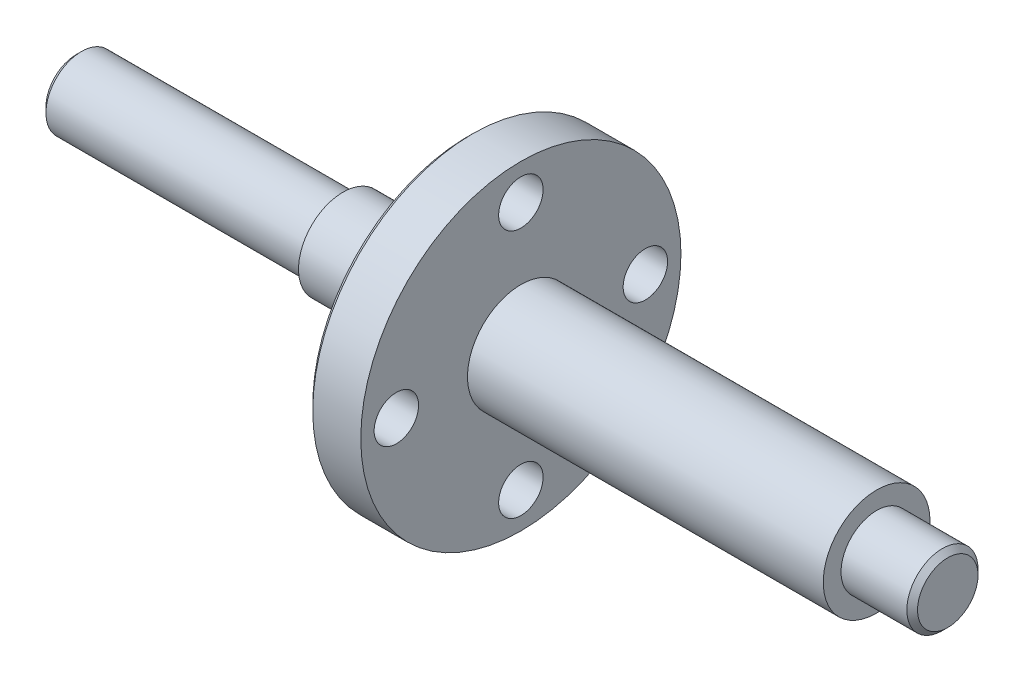
from build123d import *

# Parameters (mm, degrees)
SKETCH_1_R               = 2
EXTRUDE_1_DEPTH          = 15
SKETCH_2_R               = 2.5
EXTRUDE_2_DEPTH          = 4
SKETCH_3_R               = 3
EXTRUDE_3_DEPTH          = 3
SKETCH_4_R               = 9
EXTRUDE_4_DEPTH          = 3
SKETCH_5_R               = 3
EXTRUDE_5_DEPTH          = 20
SKETCH_8_R               = 2
EXTRUDE_6_DEPTH          = 4
HOLE_WIZARD_M3_2_D       = 2.5
PATTERN_CIRCULAR_2_COUNT = 4
CHAMFER_1_SIZE           = 0.3


with BuildPart() as part:
    # 草图1 → 凸台-拉伸1 (new body)
    with BuildSketch(Plane(origin=(0, 0, 0), x_dir=(0, 0, -1), z_dir=(1, 0, 0))):
        Circle(SKETCH_1_R)
    extrude(amount=EXTRUDE_1_DEPTH)

    # 草图2 → 凸台-拉伸2 (add)
    with BuildSketch(Plane(origin=(15, 0, 0), x_dir=(0, 0, -1), z_dir=(1, 0, 0))):
        Circle(SKETCH_2_R)
    extrude(amount=EXTRUDE_2_DEPTH)

    # 草图3 → 凸台-拉伸3 (add)
    with BuildSketch(Plane(origin=(19, 0, 0), x_dir=(0, 0, -1), z_dir=(1, 0, 0))):
        Circle(SKETCH_3_R)
    extrude(amount=EXTRUDE_3_DEPTH)

    # 草图4 → 凸台-拉伸4 (add)
    with BuildSketch(Plane(origin=(22, 0, 0), x_dir=(0, 0, -1), z_dir=(1, 0, 0))):
        Circle(SKETCH_4_R)
    extrude(amount=EXTRUDE_4_DEPTH)

    # 草图5 → 凸台-拉伸5 (add)
    with BuildSketch(Plane(origin=(25, 0, 0), x_dir=(0, 0, -1), z_dir=(1, 0, 0))):
        Circle(SKETCH_5_R)
    extrude(amount=EXTRUDE_5_DEPTH)

    # 草图8 → 凸台-拉伸6 (add)
    with BuildSketch(Plane(origin=(45, 0, 0), x_dir=(0, 0, -1), z_dir=(1, 0, 0))):
        Circle(SKETCH_8_R)
    extrude(amount=EXTRUDE_6_DEPTH)

    # M3 螺纹孔2 (through all)
    with Locations(Plane.ZY.offset(-22)):
        with Locations((0, 7)):
            hole_wizard_m3_2 = Hole(HOLE_WIZARD_M3_2_D / 2)

    # 阵列(圆周)2: M3 螺纹孔2 ×4 about axis
    pattern_circular_2_axis = Axis((0, 0, 0), (1, 0, 0))
    for i in range(1, PATTERN_CIRCULAR_2_COUNT):
        add(hole_wizard_m3_2.rotate(pattern_circular_2_axis, i * 360 / PATTERN_CIRCULAR_2_COUNT), mode=Mode.SUBTRACT)

    # 倒角1
    chamfer_1_edges = [part.edges().sort_by_distance(p)[0] for p in [
        (22, 0, 9),
        (0, 0, 2),
        (49, 0, 2),
    ]]
    chamfer(chamfer_1_edges, length=CHAMFER_1_SIZE)


solid = part.part
